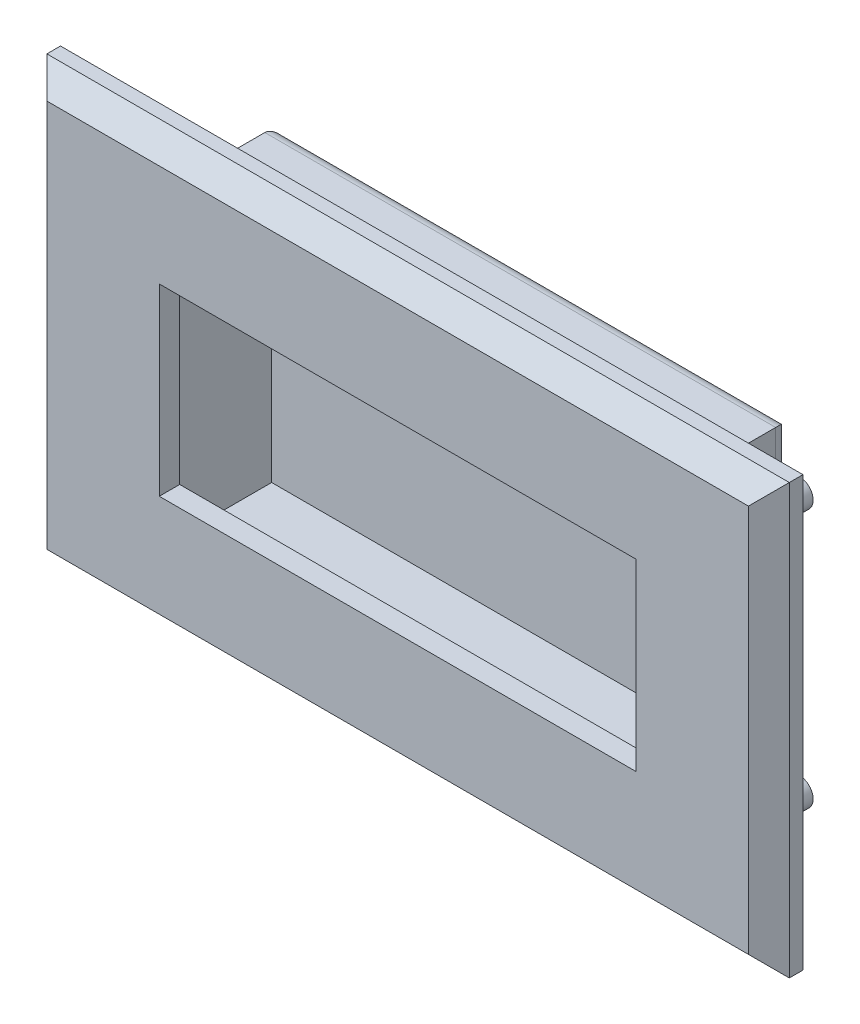
from build123d import *

# Parameters (mm, degrees)
SKETCH_1_W          = 109
SKETCH_1_H          = 63
EXTRUDE_1_DEPTH     = 5
CHAMFER_1_SIZE      = 3
SKETCH_2_W          = 75
SKETCH_2_H          = 45
EXTRUDE_2_DEPTH     = 20
SKETCH_3_W          = 70
SKETCH_3_H          = 27
CUT_EXTRUDE_1_DEPTH = 18
SKETCH_4_W          = 73
SKETCH_4_H          = 43
CUT_EXTRUDE_2_DEPTH = 15
SKETCH_5_R          = 2
EXTRUDE_3_DEPTH     = 10
FILLET_1_R          = 2


with BuildPart() as part:
    # 草图1 → 凸台-拉伸1 (new body)
    with BuildSketch(Plane.XY):
        Rectangle(SKETCH_1_W, SKETCH_1_H)
    extrude(amount=EXTRUDE_1_DEPTH)

    # 倒角1
    chamfer_1_edges = [part.edges().sort_by_distance(p)[0] for p in [
        (-54.5, 0, 5),
        (0, -31.5, 5),
        (54.5, 0, 5),
        (0, 31.5, 5),
    ]]
    chamfer(chamfer_1_edges, length=CHAMFER_1_SIZE)

    # 草图2 → 凸台-拉伸2 (add)
    with BuildSketch(Plane.XY.offset(5)):
        Rectangle(SKETCH_2_W, SKETCH_2_H)
    extrude(amount=-EXTRUDE_2_DEPTH)

    # 草图3 → 切除-拉伸1 (cut)
    with BuildSketch(Plane.XY.offset(5)):
        Rectangle(SKETCH_3_W, SKETCH_3_H)
    extrude(amount=-CUT_EXTRUDE_1_DEPTH, mode=Mode.SUBTRACT)

    # 草图4 → 切除-拉伸2 (cut)
    with BuildSketch(Plane.XY.offset(-13)):
        Rectangle(SKETCH_4_W, SKETCH_4_H)
    extrude(amount=CUT_EXTRUDE_2_DEPTH, mode=Mode.SUBTRACT)

    # 草图5 → 凸台-拉伸3 (add)
    with BuildSketch(Plane(origin=(0, 0, 0), x_dir=(-1, 0, 0), z_dir=(0, 0, -1))):
        with Locations((44, 19)):
            Circle(SKETCH_5_R)
        with Locations((44, -19)):
            Circle(SKETCH_5_R)
        with Locations((-44, -19)):
            Circle(SKETCH_5_R)
        with Locations((-44, 19)):
            Circle(SKETCH_5_R)
    extrude(amount=EXTRUDE_3_DEPTH)

    # 圆角1
    fillet_1_edges = [part.edges().sort_by_distance(p)[0] for p in [
        (37.5, 0, -15),
        (0, -22.5, -15),
        (-37.5, 0, -15),
        (0, 22.5, -15),
    ]]
    fillet(fillet_1_edges, radius=FILLET_1_R)


solid = part.part
